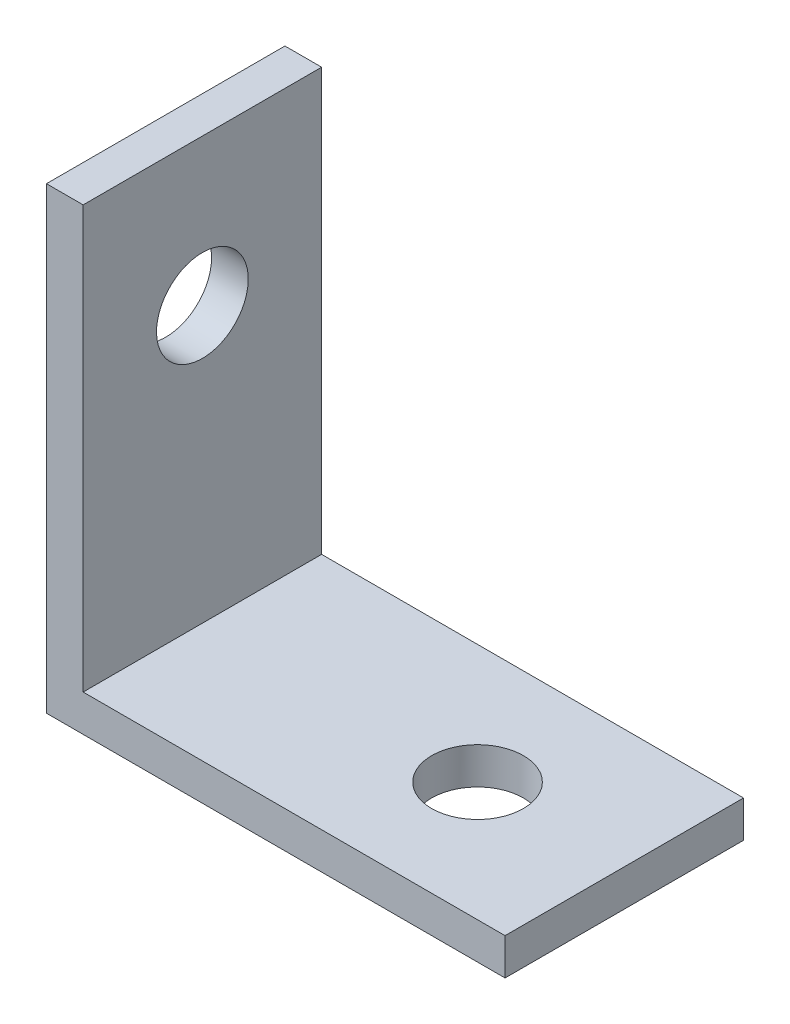
from build123d import *

# Parameters (mm, degrees)
RESSALTO_EXTRUS_O1_DEPTH = 13
ESBO_O3_R                = 2.5
CORTE_EXTRUS_O1_DEPTH    = 8
ESBO_O4_R                = 2.5
CORTE_EXTRUS_O2_DEPTH    = 8


with BuildPart() as part:
    # Esboço1 → Ressalto-extrusão1 (new body)
    with BuildSketch(Plane.XY):
        Polygon((3.510692293, 8.611985446), (3.510692293, 6.611985446), (-21.489307707, 6.611985446), (-21.489307707, 31.611985446), (-19.489307707, 31.611985446), (-19.489307707, 8.611985446), align=None)
    extrude(amount=RESSALTO_EXTRUS_O1_DEPTH)

    # Esboço3 → Corte-extrusão1 (cut)
    with BuildSketch(Plane(origin=(-19.489307707, 0, 0), x_dir=(0, 0, -1), z_dir=(1, 0, 0))):
        with Locations(Location((-6.5, 23.611985446, 0), (0, 0, 90))):
            Circle(ESBO_O3_R)
    extrude(amount=-CORTE_EXTRUS_O1_DEPTH, mode=Mode.SUBTRACT)

    # Esboço4 → Corte-extrusão2 (cut)
    with BuildSketch(Plane(origin=(0, 8.611985446, 0), x_dir=(1, 0, 0), z_dir=(0, 1, 0))):
        with Locations(Location((-4.489307707, -6.5, 0), (0, 0, 270))):
            Circle(ESBO_O4_R)
    extrude(amount=-CORTE_EXTRUS_O2_DEPTH, mode=Mode.SUBTRACT)


solid = part.part
